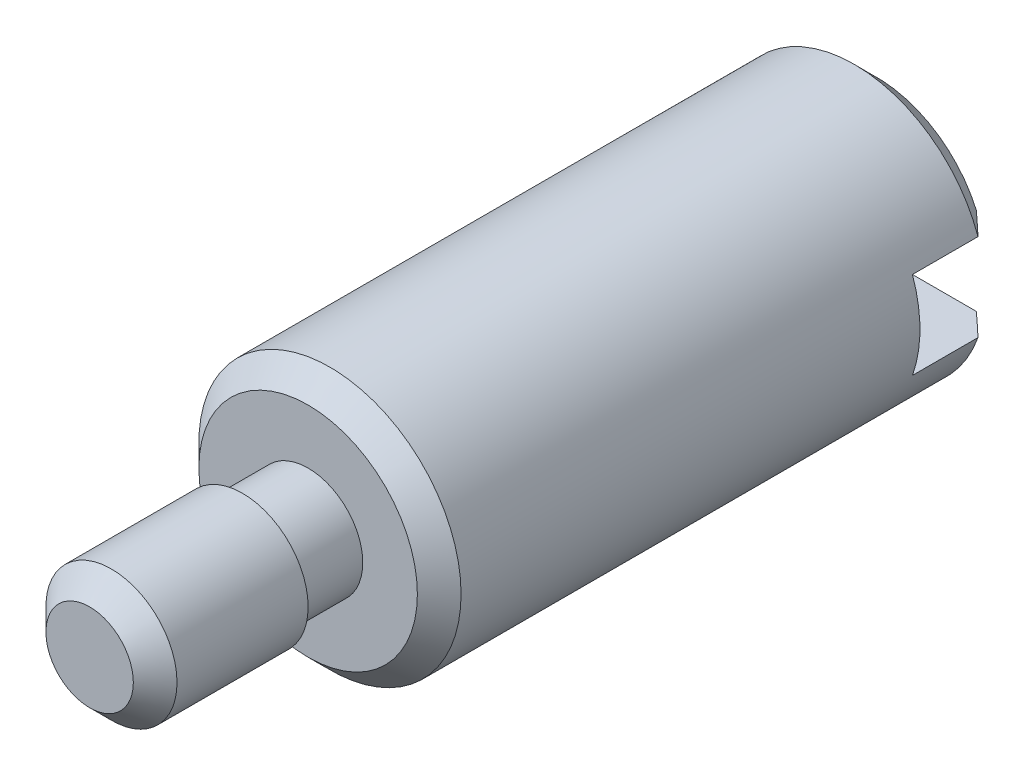
from build123d import *

# Parameters (mm, degrees)
SKETCH_1_R          = 3
EXTRUDE_1_DEPTH     = 13
SKETCH_2_R          = 1.5
EXTRUDE_2_DEPTH     = 5
CHAMFER_1_SIZE      = 0.5
SKETCH_3_R          = 1.5
SKETCH_3_R_2        = 1.25
CUT_EXTRUDE_3_DEPTH = 1.5
SKETCH_4_W          = 2
SKETCH_4_H          = 2
CUT_EXTRUDE_4_DEPTH = 10
CHAMFER_2_SIZE      = 0.5


with BuildPart() as part:
    # 草图1 → 拉伸1 (new body)
    with BuildSketch(Plane.XY):
        with Locations(Location((0, 0, 0), (0, 0, 180))):
            Circle(SKETCH_1_R)
    extrude(amount=EXTRUDE_1_DEPTH)

    # 草图2 → 拉伸2 (add)
    with BuildSketch(Plane.XY.offset(13)):
        Circle(SKETCH_2_R)
    extrude(amount=EXTRUDE_2_DEPTH)

    # 倒角1
    chamfer_1_edges = [part.edges().sort_by_distance(p)[0] for p in [
        (-1.5, 0, 18),
    ]]
    chamfer(chamfer_1_edges, length=CHAMFER_1_SIZE)

    # 草图3 → 拉伸3 (cut)
    with BuildSketch(Plane.XY.offset(13)):
        Circle(SKETCH_3_R)
        Circle(SKETCH_3_R_2, mode=Mode.SUBTRACT)
    extrude(amount=CUT_EXTRUDE_3_DEPTH, mode=Mode.SUBTRACT)

    # 草图4 → 拉伸4 (cut, symmetric)
    with BuildSketch(Plane(origin=(0, 0, 0), x_dir=(0, 0, -1), z_dir=(1, 0, 0))):
        with Locations((-1, 0)):
            Rectangle(SKETCH_4_W, SKETCH_4_H)
    extrude(amount=CUT_EXTRUDE_4_DEPTH, both=True, mode=Mode.SUBTRACT)

    # 倒角2
    chamfer_2_edges = [part.edges().sort_by_distance(p)[0] for p in [
        (0, 3, 0),
        (0, -3, 0),
        (3, 0, 13),
    ]]
    chamfer(chamfer_2_edges, length=CHAMFER_2_SIZE)


solid = part.part
